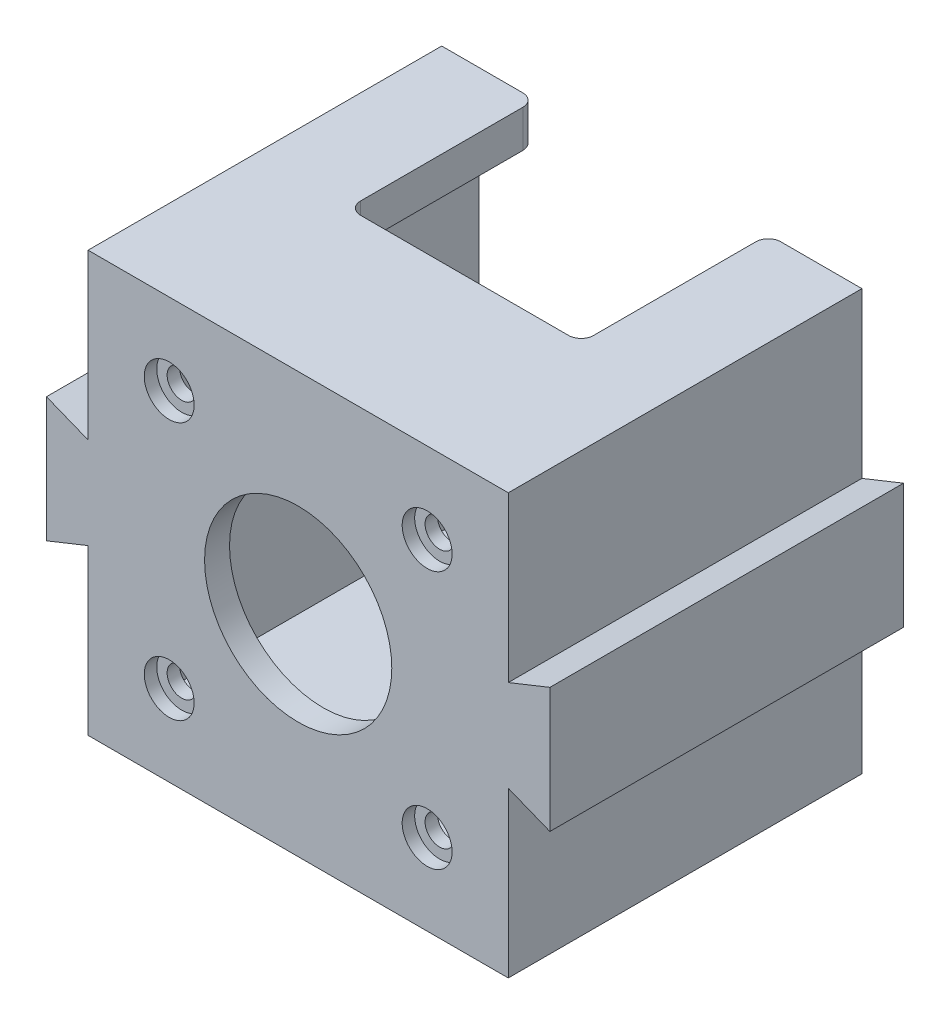
from build123d import *

# Parameters (mm, degrees)
SKETCH1_W           = 50.5
SKETCH1_H           = 50.5
SKETCH1_R           = 11.25
SKETCH1_R_2         = 1.75
BOSS_EXTRUDE1_DEPTH = 3
SKETCH1_4_W         = 50.5
SKETCH1_4_H         = 50.5
SKETCH1_4_W_2       = 42.5
SKETCH1_4_H_2       = 42.5
BOSS_EXTRUDE2_DEPTH = 39.5
SKETCH6_W           = 42.5
SKETCH6_H           = 42.5
SKETCH6_W_2         = 41.5
SKETCH6_H_2         = 41.5
BOSS_EXTRUDE4_DEPTH = 39.5
CUT_EXTRUDE1_DEPTH  = 20
FILLET1_R           = 1.5
SKETCH4_R           = 3
CUT_EXTRUDE2_DEPTH  = 1.5
BOSS_EXTRUDE3_DEPTH = 42.5


with BuildPart() as part:
    # Sketch1 → Boss-Extrude1 (new body)
    with BuildSketch(Plane.XY):
        Rectangle(SKETCH1_W, SKETCH1_H)
        Circle(SKETCH1_R, mode=Mode.SUBTRACT)
        with Locations((-15.5, 15.5)):
            Circle(SKETCH1_R_2, mode=Mode.SUBTRACT)
        with Locations((15.5, 15.5)):
            Circle(SKETCH1_R_2, mode=Mode.SUBTRACT)
        with Locations((-15.5, -15.5)):
            Circle(SKETCH1_R_2, mode=Mode.SUBTRACT)
        with Locations((15.5, -15.5)):
            Circle(SKETCH1_R_2, mode=Mode.SUBTRACT)
    extrude(amount=BOSS_EXTRUDE1_DEPTH)

    # Sketch1<4> → Boss-Extrude2 (add)
    with BuildSketch(Plane.XY):
        Rectangle(SKETCH1_4_W, SKETCH1_4_H)
        Rectangle(SKETCH1_4_W_2, SKETCH1_4_H_2, mode=Mode.SUBTRACT)
    extrude(amount=-BOSS_EXTRUDE2_DEPTH)

    # Sketch6 → Boss-Extrude4 (add)
    with BuildSketch(Plane(origin=(0, 0, 0), x_dir=(-1, 0, 0), z_dir=(0, 0, -1))):
        Rectangle(SKETCH6_W, SKETCH6_H)
        Rectangle(SKETCH6_W_2, SKETCH6_H_2, mode=Mode.SUBTRACT)
    extrude(amount=BOSS_EXTRUDE4_DEPTH)

    # Sketch2 → Cut-Extrude1 (cut)
    with BuildSketch(Plane(origin=(0, 25.25, 0), x_dir=(1, 0, 0), z_dir=(0, 1, 0))):
        with BuildLine():
            Line((-14, 39.5), (14, 39.5))
            Line((14, 39.5), (14, 18.5))
            ThreePointArc((14, 18.5), (13.560660172, 17.439339828), (12.5, 17))
            Line((12.5, 17), (-12.5, 17))
            ThreePointArc((-12.5, 17), (-13.560660172, 17.439339828), (-14, 18.5))
            Line((-14, 18.5), (-14, 39.5))
        make_face()
    extrude(amount=-CUT_EXTRUDE1_DEPTH, mode=Mode.SUBTRACT)

    # Fillet1
    fillet1_edges = [part.edges().sort_by_distance(p)[0] for p in [
        (-14, 23, -39.5),
        (14, 23, -39.5),
    ]]
    fillet(fillet1_edges, radius=FILLET1_R)

    # Sketch4 → Cut-Extrude2 (cut)
    with BuildSketch(Plane.XY.offset(3)):
        with Locations((15.5, 15.5)):
            Circle(SKETCH4_R)
        with Locations((15.5, -15.5)):
            Circle(SKETCH4_R)
        with Locations((-15.5, 15.5)):
            Circle(SKETCH4_R)
        with Locations((-15.5, -15.5)):
            Circle(SKETCH4_R)
    extrude(amount=-CUT_EXTRUDE2_DEPTH, mode=Mode.SUBTRACT)

    # Sketch5 → Boss-Extrude3 (add)
    with BuildSketch(Plane.XY.offset(3)):
        Polygon((25.25, 5.5), (30.25, 7.5), (30.25, -7.5), (25.25, -5.5), align=None)
        Polygon((-30.25, -7.5), (-25.25, -5.5), (-25.25, 5.5), (-30.25, 7.5), align=None)
    extrude(amount=-BOSS_EXTRUDE3_DEPTH)


solid = part.part
